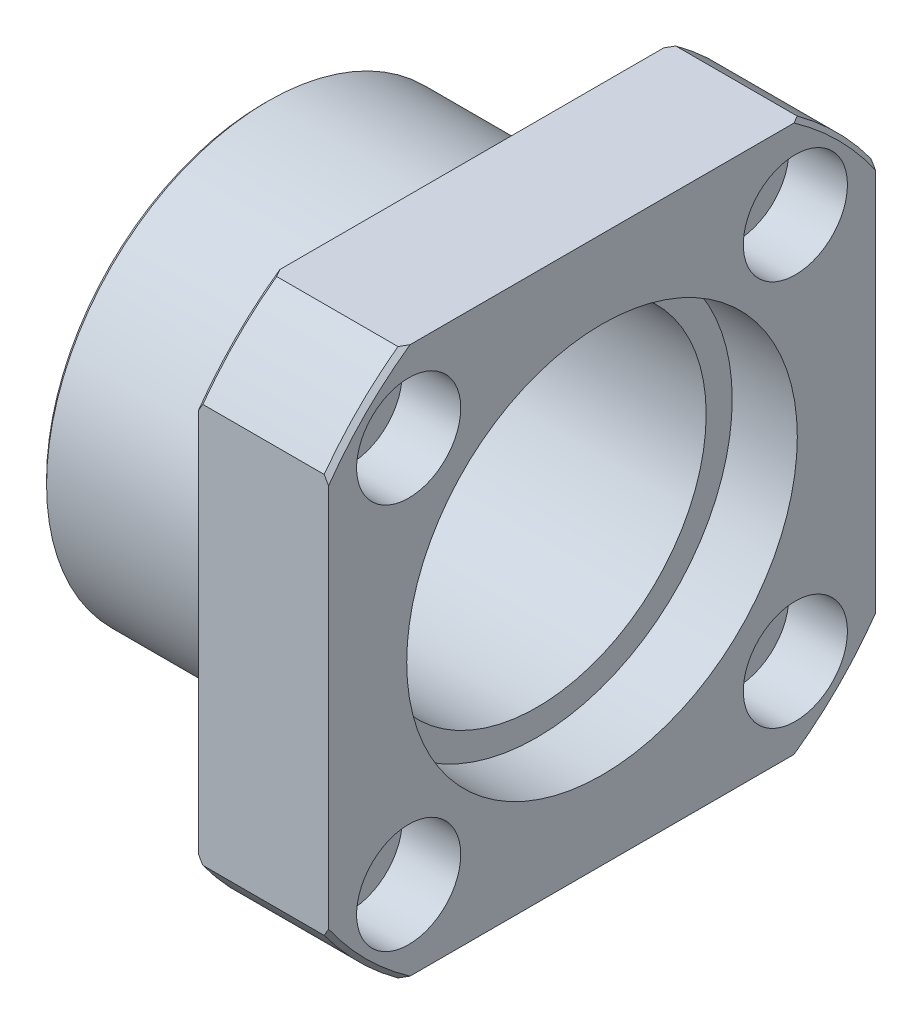
from build123d import *

# Parameters (mm, degrees)
BOSS_EXTRUDE1_DEPTH                              = 10
SKETCH2_W                                        = 16
SKETCH2_H                                        = 17
CBORE_FOR_M4_HEX_HEAD_MACHINE_SCREW1_D           = 4.5
CBORE_FOR_M4_HEX_HEAD_MACHINE_SCREW1_DEPTH       = 26
CBORE_FOR_M4_HEX_HEAD_MACHINE_SCREW1_CBORE_D     = 8
CBORE_FOR_M4_HEX_HEAD_MACHINE_SCREW1_CBORE_DEPTH = 4.5
CHAMFER1_SIZE                                    = 0.34
FILLET1_R                                        = 0.3


with BuildPart() as part:
    # Sketch1 → Boss-Extrude1 (new body)
    with BuildSketch(Plane(origin=(26, 0, 0), x_dir=(0, 0, -1), z_dir=(1, 0, 0))):
        with BuildLine():
            Line((21, -15.329709717), (21, 15.329709717))
            ThreePointArc((21, 15.329709717), (18.384776311, 18.384776311), (15.329709717, 21))
            Line((15.329709717, 21), (-15.329709717, 21))
            ThreePointArc((-15.329709717, 21), (-18.384776311, 18.384776311), (-21, 15.329709717))
            Line((-21, 15.329709717), (-21, -15.329709717))
            ThreePointArc((-21, -15.329709717), (-18.384776311, -18.384776311), (-15.329709717, -21))
            Line((-15.329709717, -21), (15.329709717, -21))
            ThreePointArc((15.329709717, -21), (18.384776311, -18.384776311), (21, -15.329709717))
        make_face()
    extrude(amount=-BOSS_EXTRUDE1_DEPTH)

    # Sketch2 → Revolve1 (revolve)
    with BuildSketch(Plane.XY, mode=Mode.PRIVATE) as revolve1_sk:
        with Locations((8, 8.5)):
            Rectangle(SKETCH2_W, SKETCH2_H)
    revolve(revolve1_sk.sketch.rotate(Axis((0, 0, 0), (1, 0, 0)), 270), axis=Axis((0, 0, 0), (1, 0, 0)))

    # Sketch3 → Cut-Revolve1 (revolve, cut)
    with BuildSketch(Plane.XY, mode=Mode.PRIVATE) as cut_revolve1_sk:
        Polygon((0, 7.25), (0, 0), (26, 0), (26, 15), (21, 15), (21, 13), (5, 13), (5, 7.25), align=None)
    revolve(cut_revolve1_sk.sketch.rotate(Axis((0, 0, 0), (1, 0, 0)), 270), axis=Axis((0, 0, 0), (1, 0, 0)), mode=Mode.SUBTRACT)

    # CBORE for M4 Hex Head Machine Screw1
    with Locations(Plane(origin=(26, 0, 0), x_dir=(0, 0, -1), z_dir=(1, 0, 0))):
        with Locations((-14.849242405, 14.849242405), (14.849242405, -14.849242405), (14.849242405, 14.849242405), (-14.849242405, -14.849242405)):
            CounterBoreHole(CBORE_FOR_M4_HEX_HEAD_MACHINE_SCREW1_D / 2, CBORE_FOR_M4_HEX_HEAD_MACHINE_SCREW1_CBORE_D / 2, CBORE_FOR_M4_HEX_HEAD_MACHINE_SCREW1_CBORE_DEPTH, depth=CBORE_FOR_M4_HEX_HEAD_MACHINE_SCREW1_DEPTH)

    # Chamfer1
    chamfer1_edges = [part.edges().sort_by_distance(p)[0] for p in [
        (16, 18.384776311, -18.384776311),
        (26, -18.384776311, -18.384776311),
        (16, 18.384776311, 18.384776311),
        (16, -18.384776311, 18.384776311),
        (0, 0, 17),
        (16, -18.384776311, -18.384776311),
        (26, -18.384776311, 18.384776311),
        (26, 18.384776311, 18.384776311),
        (26, 18.384776311, -18.384776311),
    ]]
    chamfer(chamfer1_edges, length=CHAMFER1_SIZE)

    # Fillet1
    fillet1_edges = [part.edges().sort_by_distance(p)[0] for p in [
        (16, 0, 17),
    ]]
    fillet(fillet1_edges, radius=FILLET1_R)


solid = part.part
